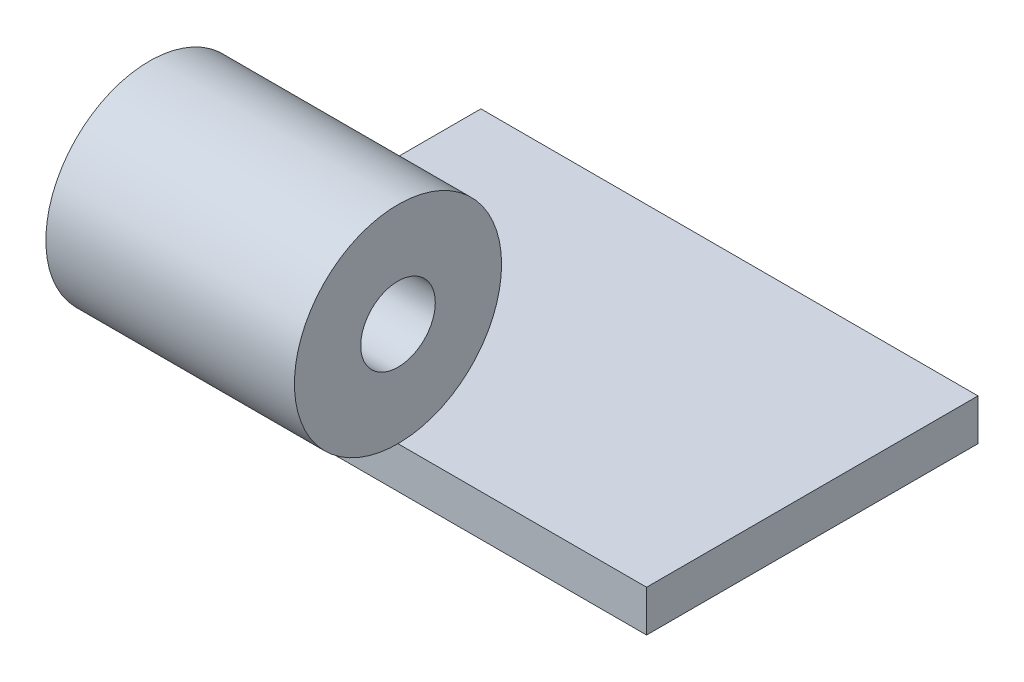
from build123d import *

# Parameters (mm, degrees)
SKETCH_4_W       = 40
SKETCH_4_H       = 5
EXTRUDE_5_DEPTH  = 30
SKETCH_9_R       = 12.5
SKETCH_9_R_2     = 4.5
EXTRUDE_8_DEPTH  = 30
EXTRUDE_START    = -30
SKETCH_9_2_R     = 12.5
EXTRUDE_10_DEPTH = 5


with BuildPart() as part:
    # Эскиз4 → Бобышка-Вытянуть5 (new, symmetric)
    with BuildSketch(Plane(origin=(0, 0, 0), x_dir=(0, 0, -1), z_dir=(1, 0, 0))):
        with Locations((0, -2.5)):
            Rectangle(SKETCH_4_W, SKETCH_4_H)
    extrude(amount=EXTRUDE_5_DEPTH, both=True)


with BuildPart() as body_2:
    # Эскиз9 → Вытянуть-Тонкостенный8 (new body)
    with BuildSketch(Plane(origin=(0, 0, 0), x_dir=(0, 0, -1), z_dir=(1, 0, 0))):
        with Locations((-20, 12.5)):
            Circle(SKETCH_9_R)
        with Locations((-20, 12.5)):
            Circle(SKETCH_9_R_2, mode=Mode.SUBTRACT)
    extrude(amount=-EXTRUDE_8_DEPTH)

    # Эскиз9<2> → Бобышка-Вытянуть10 (add)
    with BuildSketch(Plane(origin=(0, 0, 0), x_dir=(0, 0, -1), z_dir=(1, 0, 0)).offset(EXTRUDE_START)):
        with Locations((-20, 12.5)):
            Circle(SKETCH_9_2_R)
    extrude(amount=EXTRUDE_10_DEPTH)


solid = Compound([part.part, body_2.part])
